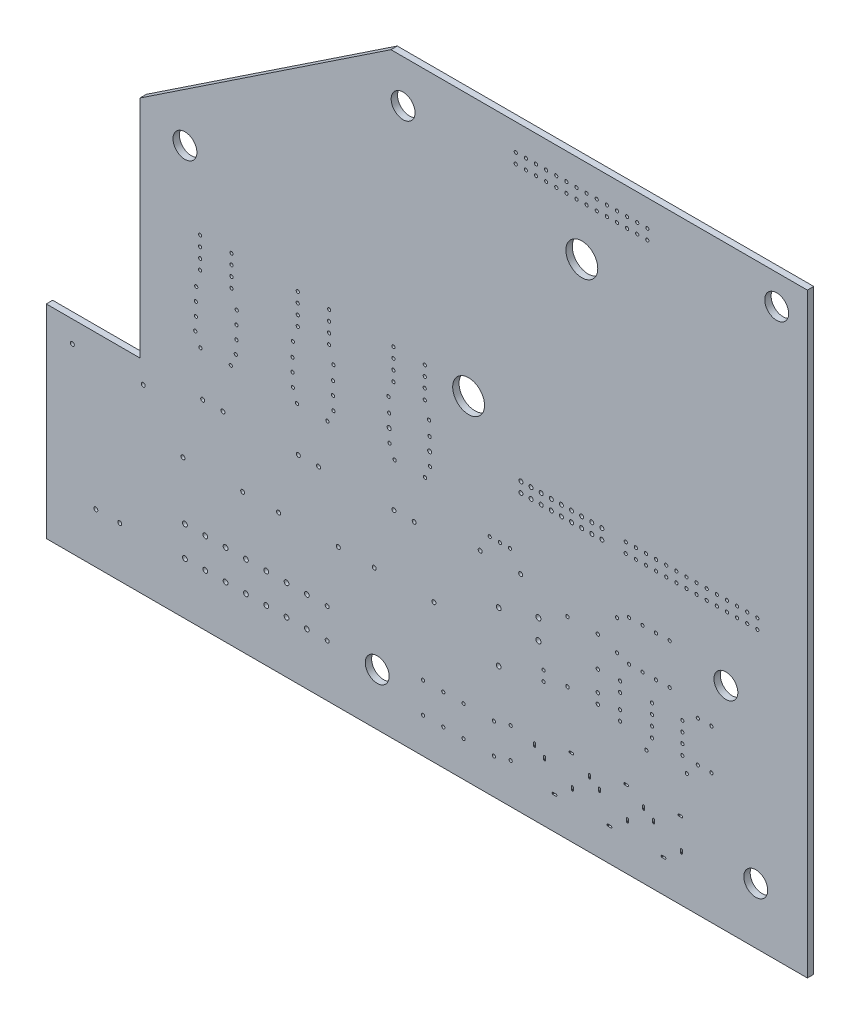
from build123d import *

# Parameters (mm, degrees)
SKETCH1_R           = 3
SKETCH1_R_2         = 0.4
SKETCH1_R_3         = 0.425
SKETCH1_R_4         = 0.65
SKETCH1_R_5         = 0.6
SKETCH1_R_6         = 0.5
SKETCH1_R_7         = 4
BOSS_EXTRUDE1_DEPTH = 1.6


with BuildPart() as part:
    # Sketch1 → Boss-Extrude1 (new body)
    with BuildSketch(Plane(origin=(0, 0, 0), x_dir=(-1, 0, 0), z_dir=(0, 0, -1))):
        Polygon((-318, -203.5), (-127, -203.5), (-127, -152.499999755), (-150.5, -152.499999755), (-150.5, -96), (-213.5, -54), (-318, -54), align=None)
        with Locations(Location((-305.05, -189.44, 0), (0, 0, 180))):
            Circle(SKETCH1_R, mode=Mode.SUBTRACT)
        with Locations(Location((-293.91, -170.95, 0), (0, 0, 180))):
            Circle(SKETCH1_R_2, mode=Mode.SUBTRACT)
        with Locations(Location((-287.755, -174.19, 0), (0, 0, 180))):
            Circle(SKETCH1_R_2, mode=Mode.SUBTRACT)
        with Locations(Location((-290.51, -170.95, 0), (0, 0, 180))):
            Circle(SKETCH1_R_2, mode=Mode.SUBTRACT)
        with Locations(Location((-286.625, -170.81, 0), (0, 0, 180))):
            Circle(SKETCH1_R_2, mode=Mode.SUBTRACT)
        with Locations(Location((-277.595, -174.19, 0), (0, 0, 180))):
            Circle(SKETCH1_R_2, mode=Mode.SUBTRACT)
        with Locations(Location((-279.005, -170.81, 0), (0, 0, 180))):
            Circle(SKETCH1_R_2, mode=Mode.SUBTRACT)
        with Locations(Location((-271.005, -171.19, 0), (0, 0, 180))):
            Circle(SKETCH1_R_2, mode=Mode.SUBTRACT)
        with Locations(Location((-286.625, -168.27, 0), (0, 0, 180))):
            Circle(SKETCH1_R_2, mode=Mode.SUBTRACT)
        with Locations(Location((-286.625, -165.73, 0), (0, 0, 180))):
            Circle(SKETCH1_R_2, mode=Mode.SUBTRACT)
        with Locations(Location((-286.625, -163.19, 0), (0, 0, 180))):
            Circle(SKETCH1_R_2, mode=Mode.SUBTRACT)
        with Locations(Location((-279.005, -168.27, 0), (0, 0, 180))):
            Circle(SKETCH1_R_2, mode=Mode.SUBTRACT)
        with Locations(Location((-279.005, -165.73, 0), (0, 0, 180))):
            Circle(SKETCH1_R_2, mode=Mode.SUBTRACT)
        with Locations(Location((-271.005, -168.69, 0), (0, 0, 180))):
            Circle(SKETCH1_R_2, mode=Mode.SUBTRACT)
        with Locations(Location((-279.005, -163.19, 0), (0, 0, 180))):
            Circle(SKETCH1_R_2, mode=Mode.SUBTRACT)
        with Locations(Location((-271.005, -164.94, 0), (0, 0, 180))):
            Circle(SKETCH1_R_2, mode=Mode.SUBTRACT)
        with Locations(Location((-271.005, -162.44, 0), (0, 0, 180))):
            Circle(SKETCH1_R_2, mode=Mode.SUBTRACT)
        with Locations(Location((-243.55, -193.44, 0), (0, 0, 180))):
            Circle(SKETCH1_R_2, mode=Mode.SUBTRACT)
        with Locations(Location((-239.34, -194.62, 0), (0, 0, 180))):
            Circle(SKETCH1_R_2, mode=Mode.SUBTRACT)
        with Locations(Location((-239.34, -187, 0), (0, 0, 180))):
            Circle(SKETCH1_R_2, mode=Mode.SUBTRACT)
        with Locations(Location((-231.72, -194.62, 0), (0, 0, 180))):
            Circle(SKETCH1_R_2, mode=Mode.SUBTRACT)
        with Locations(Location((-226.64, -194.62, 0), (0, 0, 180))):
            Circle(SKETCH1_R_2, mode=Mode.SUBTRACT)
        with Locations(Location((-231.72, -187, 0), (0, 0, 180))):
            Circle(SKETCH1_R_2, mode=Mode.SUBTRACT)
        with Locations(Location((-226.64, -187, 0), (0, 0, 180))):
            Circle(SKETCH1_R_2, mode=Mode.SUBTRACT)
        with Locations(Location((-243.55, -185.82, 0), (0, 0, 180))):
            Circle(SKETCH1_R_2, mode=Mode.SUBTRACT)
        with Locations(Location((-265.42, -170.31, 0), (0, 0, 180))):
            Circle(SKETCH1_R_3, mode=Mode.SUBTRACT)
        with Locations(Location((-257.8, -170.31, 0), (0, 0, 180))):
            Circle(SKETCH1_R_3, mode=Mode.SUBTRACT)
        with Locations(Location((-251.8, -172.19, 0), (0, 0, 180))):
            Circle(SKETCH1_R_2, mode=Mode.SUBTRACT)
        with Locations(Location((-265.42, -167.77, 0), (0, 0, 180))):
            Circle(SKETCH1_R_3, mode=Mode.SUBTRACT)
        with Locations(Location((-265.42, -162.69, 0), (0, 0, 180))):
            Circle(SKETCH1_R_3, mode=Mode.SUBTRACT)
        with Locations(Location((-251.8, -169.69, 0), (0, 0, 180))):
            Circle(SKETCH1_R_2, mode=Mode.SUBTRACT)
        with Locations(Location((-250.5, -163.94, 0), (0, 0, 180))):
            Circle(SKETCH1_R_4, mode=Mode.SUBTRACT)
        with Locations(Location((-240.55, -174.44, 0), (0, 0, 180))):
            Circle(SKETCH1_R_5, mode=Mode.SUBTRACT)
        with Locations(Location((-240.55, -161.74, 0), (0, 0, 180))):
            Circle(SKETCH1_R_5, mode=Mode.SUBTRACT)
        with Locations(Location((-224.293, -168.683, 0), (0, 0, 180))):
            Circle(SKETCH1_R_6, mode=Mode.SUBTRACT)
        with Locations(Location((-293.91, -160.79, 0), (0, 0, 180))):
            Circle(SKETCH1_R_2, mode=Mode.SUBTRACT)
        with Locations(Location((-297.55, -150.19, 0), (0, 0, 180))):
            Circle(SKETCH1_R, mode=Mode.SUBTRACT)
        with Locations(Location((-290.51, -160.79, 0), (0, 0, 180))):
            Circle(SKETCH1_R_2, mode=Mode.SUBTRACT)
        with Locations(Location((-283.449999, -157.635001, 0), (0, 0, 180))):
            Circle(SKETCH1_R_2, mode=Mode.SUBTRACT)
        with Locations(Location((-280.005, -157.69, 0), (0, 0, 180))):
            Circle(SKETCH1_R_2, mode=Mode.SUBTRACT)
        with Locations(Location((-276.64, -157.69, 0), (0, 0, 180))):
            Circle(SKETCH1_R_2, mode=Mode.SUBTRACT)
        with Locations(Location((-273.255, -157.69, 0), (0, 0, 180))):
            Circle(SKETCH1_R_2, mode=Mode.SUBTRACT)
        with Locations(Location((-270.255, -156.69, 0), (0, 0, 180))):
            Circle(SKETCH1_R_2, mode=Mode.SUBTRACT)
        with Locations(Location((-283.449999, -147.475001, 0), (0, 0, 180))):
            Circle(SKETCH1_R_2, mode=Mode.SUBTRACT)
        with Locations(Location((-280.005, -147.53, 0), (0, 0, 180))):
            Circle(SKETCH1_R_2, mode=Mode.SUBTRACT)
        with Locations(Location((-270.255, -149.07, 0), (0, 0, 180))):
            Circle(SKETCH1_R_2, mode=Mode.SUBTRACT)
        with Locations(Location((-276.64, -147.53, 0), (0, 0, 180))):
            Circle(SKETCH1_R_2, mode=Mode.SUBTRACT)
        with Locations(Location((-273.255, -147.53, 0), (0, 0, 180))):
            Circle(SKETCH1_R_2, mode=Mode.SUBTRACT)
        with Locations(Location((-305.44, -134.04, 0), (0, 0, 180))):
            Circle(SKETCH1_R_2, mode=Mode.SUBTRACT)
        with Locations(Location((-302.9, -134.04, 0), (0, 0, 180))):
            Circle(SKETCH1_R_2, mode=Mode.SUBTRACT)
        with Locations(Location((-305.44, -131.5, 0), (0, 0, 180))):
            Circle(SKETCH1_R_2, mode=Mode.SUBTRACT)
        with Locations(Location((-302.9, -131.5, 0), (0, 0, 180))):
            Circle(SKETCH1_R_2, mode=Mode.SUBTRACT)
        with Locations(Location((-300.36, -134.04, 0), (0, 0, 180))):
            Circle(SKETCH1_R_2, mode=Mode.SUBTRACT)
        with Locations(Location((-297.82, -134.04, 0), (0, 0, 180))):
            Circle(SKETCH1_R_2, mode=Mode.SUBTRACT)
        with Locations(Location((-300.36, -131.5, 0), (0, 0, 180))):
            Circle(SKETCH1_R_2, mode=Mode.SUBTRACT)
        with Locations(Location((-297.82, -131.5, 0), (0, 0, 180))):
            Circle(SKETCH1_R_2, mode=Mode.SUBTRACT)
        with Locations(Location((-295.28, -134.04, 0), (0, 0, 180))):
            Circle(SKETCH1_R_2, mode=Mode.SUBTRACT)
        with Locations(Location((-292.74, -134.04, 0), (0, 0, 180))):
            Circle(SKETCH1_R_2, mode=Mode.SUBTRACT)
        with Locations(Location((-295.28, -131.5, 0), (0, 0, 180))):
            Circle(SKETCH1_R_2, mode=Mode.SUBTRACT)
        with Locations(Location((-292.74, -131.5, 0), (0, 0, 180))):
            Circle(SKETCH1_R_2, mode=Mode.SUBTRACT)
        with Locations(Location((-290.2, -134.04, 0), (0, 0, 180))):
            Circle(SKETCH1_R_2, mode=Mode.SUBTRACT)
        with Locations(Location((-287.66, -134.04, 0), (0, 0, 180))):
            Circle(SKETCH1_R_2, mode=Mode.SUBTRACT)
        with Locations(Location((-290.2, -131.5, 0), (0, 0, 180))):
            Circle(SKETCH1_R_2, mode=Mode.SUBTRACT)
        with Locations(Location((-287.66, -131.5, 0), (0, 0, 180))):
            Circle(SKETCH1_R_2, mode=Mode.SUBTRACT)
        with Locations(Location((-285.12, -134.04, 0), (0, 0, 180))):
            Circle(SKETCH1_R_2, mode=Mode.SUBTRACT)
        with Locations(Location((-282.58, -134.04, 0), (0, 0, 180))):
            Circle(SKETCH1_R_2, mode=Mode.SUBTRACT)
        with Locations(Location((-280.04, -134.04, 0), (0, 0, 180))):
            Circle(SKETCH1_R_2, mode=Mode.SUBTRACT)
        with Locations(Location((-285.12, -131.5, 0), (0, 0, 180))):
            Circle(SKETCH1_R_2, mode=Mode.SUBTRACT)
        with Locations(Location((-282.58, -131.5, 0), (0, 0, 180))):
            Circle(SKETCH1_R_2, mode=Mode.SUBTRACT)
        with Locations(Location((-280.04, -131.5, 0), (0, 0, 180))):
            Circle(SKETCH1_R_2, mode=Mode.SUBTRACT)
        with Locations(Location((-277.5, -134.04, 0), (0, 0, 180))):
            Circle(SKETCH1_R_2, mode=Mode.SUBTRACT)
        with Locations(Location((-274.96, -134.04, 0), (0, 0, 180))):
            Circle(SKETCH1_R_2, mode=Mode.SUBTRACT)
        with Locations(Location((-277.5, -131.5, 0), (0, 0, 180))):
            Circle(SKETCH1_R_2, mode=Mode.SUBTRACT)
        with Locations(Location((-274.96, -131.5, 0), (0, 0, 180))):
            Circle(SKETCH1_R_2, mode=Mode.SUBTRACT)
        with Locations(Location((-272.42, -134.04, 0), (0, 0, 180))):
            Circle(SKETCH1_R_2, mode=Mode.SUBTRACT)
        with Locations(Location((-272.42, -131.5, 0), (0, 0, 180))):
            Circle(SKETCH1_R_2, mode=Mode.SUBTRACT)
        with Locations(Location((-265.42, -155.07, 0), (0, 0, 180))):
            Circle(SKETCH1_R_3, mode=Mode.SUBTRACT)
        with Locations(Location((-257.8, -155.07, 0), (0, 0, 180))):
            Circle(SKETCH1_R_3, mode=Mode.SUBTRACT)
        with Locations(Location((-250.5, -158.94, 0), (0, 0, 180))):
            Circle(SKETCH1_R_4, mode=Mode.SUBTRACT)
        with Locations(Location((-246.05, -151.69, 0), (0, 0, 180))):
            Circle(SKETCH1_R_6, mode=Mode.SUBTRACT)
        with Locations(Location((-235.89, -151.69, 0), (0, 0, 180))):
            Circle(SKETCH1_R_6, mode=Mode.SUBTRACT)
        with Locations(Location((-243.38, -147.44, 0), (0, 0, 180))):
            Circle(SKETCH1_R_2, mode=Mode.SUBTRACT)
        with Locations(Location((-240.84, -147.44, 0), (0, 0, 180))):
            Circle(SKETCH1_R_2, mode=Mode.SUBTRACT)
        with Locations(Location((-238.3, -147.44, 0), (0, 0, 180))):
            Circle(SKETCH1_R_2, mode=Mode.SUBTRACT)
        with Locations(Location((-266.44, -134.04, 0), (0, 0, 180))):
            Circle(SKETCH1_R_6, mode=Mode.SUBTRACT)
        with Locations(Location((-263.9, -134.04, 0), (0, 0, 180))):
            Circle(SKETCH1_R_6, mode=Mode.SUBTRACT)
        with Locations(Location((-266.44, -131.5, 0), (0, 0, 180))):
            Circle(SKETCH1_R_6, mode=Mode.SUBTRACT)
        with Locations(Location((-263.9, -131.5, 0), (0, 0, 180))):
            Circle(SKETCH1_R_6, mode=Mode.SUBTRACT)
        with Locations(Location((-261.36, -134.04, 0), (0, 0, 180))):
            Circle(SKETCH1_R_6, mode=Mode.SUBTRACT)
        with Locations(Location((-258.82, -134.04, 0), (0, 0, 180))):
            Circle(SKETCH1_R_6, mode=Mode.SUBTRACT)
        with Locations(Location((-261.36, -131.5, 0), (0, 0, 180))):
            Circle(SKETCH1_R_6, mode=Mode.SUBTRACT)
        with Locations(Location((-258.82, -131.5, 0), (0, 0, 180))):
            Circle(SKETCH1_R_6, mode=Mode.SUBTRACT)
        with Locations(Location((-256.28, -134.04, 0), (0, 0, 180))):
            Circle(SKETCH1_R_6, mode=Mode.SUBTRACT)
        with Locations(Location((-253.74, -134.04, 0), (0, 0, 180))):
            Circle(SKETCH1_R_6, mode=Mode.SUBTRACT)
        with Locations(Location((-256.28, -131.5, 0), (0, 0, 180))):
            Circle(SKETCH1_R_6, mode=Mode.SUBTRACT)
        with Locations(Location((-253.74, -131.5, 0), (0, 0, 180))):
            Circle(SKETCH1_R_6, mode=Mode.SUBTRACT)
        with Locations(Location((-251.2, -134.04, 0), (0, 0, 180))):
            Circle(SKETCH1_R_6, mode=Mode.SUBTRACT)
        with Locations(Location((-248.66, -134.04, 0), (0, 0, 180))):
            Circle(SKETCH1_R_6, mode=Mode.SUBTRACT)
        with Locations(Location((-246.12, -134.04, 0), (0, 0, 180))):
            Circle(SKETCH1_R_6, mode=Mode.SUBTRACT)
        with Locations(Location((-251.2, -131.5, 0), (0, 0, 180))):
            Circle(SKETCH1_R_6, mode=Mode.SUBTRACT)
        with Locations(Location((-248.66, -131.5, 0), (0, 0, 180))):
            Circle(SKETCH1_R_6, mode=Mode.SUBTRACT)
        with Locations(Location((-246.12, -131.5, 0), (0, 0, 180))):
            Circle(SKETCH1_R_6, mode=Mode.SUBTRACT)
        with Locations(Location((-223.3, -139.69, 0), (0, 0, 180))):
            Circle(SKETCH1_R_2, mode=Mode.SUBTRACT)
        with Locations(Location((-223.21, -136.44, 0), (0, 0, 180))):
            Circle(SKETCH1_R_6, mode=Mode.SUBTRACT)
        with Locations(Location((-223.21, -133.19, 0), (0, 0, 180))):
            Circle(SKETCH1_R_2, mode=Mode.SUBTRACT)
        with Locations(Location((-221.56, -194.62, 0), (0, 0, 180))):
            Circle(SKETCH1_R_2, mode=Mode.SUBTRACT)
        with Locations(Location((-221.56, -187, 0), (0, 0, 180))):
            Circle(SKETCH1_R_2, mode=Mode.SUBTRACT)
        with Locations(Location((-210.05, -190.44, 0), (0, 0, 180))):
            Circle(SKETCH1_R, mode=Mode.SUBTRACT)
        with Locations(Location((-197.5, -190.44, 0), (0, 0, 180))):
            Circle(SKETCH1_R_6, mode=Mode.SUBTRACT)
        with Locations(Location((-192.4, -190.44, 0), (0, 0, 180))):
            Circle(SKETCH1_R_5, mode=Mode.SUBTRACT)
        with Locations(Location((-187.3, -190.44, 0), (0, 0, 180))):
            Circle(SKETCH1_R_5, mode=Mode.SUBTRACT)
        with Locations(Location((-182.2, -190.44, 0), (0, 0, 180))):
            Circle(SKETCH1_R_5, mode=Mode.SUBTRACT)
        with Locations(Location((-197.5, -182.94, 0), (0, 0, 180))):
            Circle(SKETCH1_R_6, mode=Mode.SUBTRACT)
        with Locations(Location((-192.4, -182.94, 0), (0, 0, 180))):
            Circle(SKETCH1_R_5, mode=Mode.SUBTRACT)
        with Locations(Location((-187.3, -182.94, 0), (0, 0, 180))):
            Circle(SKETCH1_R_5, mode=Mode.SUBTRACT)
        with Locations(Location((-182.2, -182.94, 0), (0, 0, 180))):
            Circle(SKETCH1_R_5, mode=Mode.SUBTRACT)
        with Locations(Location((-209.307, -168.683, 0), (0, 0, 180))):
            Circle(SKETCH1_R_6, mode=Mode.SUBTRACT)
        with Locations(Location((-200.293, -168.683, 0), (0, 0, 180))):
            Circle(SKETCH1_R_6, mode=Mode.SUBTRACT)
        with Locations(Location((-185.307, -168.683, 0), (0, 0, 180))):
            Circle(SKETCH1_R_6, mode=Mode.SUBTRACT)
        with Locations(Location((-177.1, -190.44, 0), (0, 0, 180))):
            Circle(SKETCH1_R_5, mode=Mode.SUBTRACT)
        with Locations(Location((-172, -190.44, 0), (0, 0, 180))):
            Circle(SKETCH1_R_5, mode=Mode.SUBTRACT)
        with Locations(Location((-166.9, -190.44, 0), (0, 0, 180))):
            Circle(SKETCH1_R_5, mode=Mode.SUBTRACT)
        with Locations(Location((-161.8, -190.44, 0), (0, 0, 180))):
            Circle(SKETCH1_R_5, mode=Mode.SUBTRACT)
        with Locations(Location((-177.1, -182.94, 0), (0, 0, 180))):
            Circle(SKETCH1_R_5, mode=Mode.SUBTRACT)
        with Locations(Location((-172, -182.94, 0), (0, 0, 180))):
            Circle(SKETCH1_R_5, mode=Mode.SUBTRACT)
        with Locations(Location((-166.9, -182.94, 0), (0, 0, 180))):
            Circle(SKETCH1_R_5, mode=Mode.SUBTRACT)
        with Locations(Location((-161.8, -182.94, 0), (0, 0, 180))):
            Circle(SKETCH1_R_5, mode=Mode.SUBTRACT)
        with Locations(Location((-145.44, -190.91, 0), (0, 0, 180))):
            Circle(SKETCH1_R_6, mode=Mode.SUBTRACT)
        with Locations(Location((-139.44, -190.91, 0), (0, 0, 180))):
            Circle(SKETCH1_R_6, mode=Mode.SUBTRACT)
        with Locations(Location((-176.293, -168.683, 0), (0, 0, 180))):
            Circle(SKETCH1_R_6, mode=Mode.SUBTRACT)
        with Locations(Location((-161.307, -168.683, 0), (0, 0, 180))):
            Circle(SKETCH1_R_6, mode=Mode.SUBTRACT)
        with Locations(Location((-219.34, -153.697, 0), (0, 0, 180))):
            Circle(SKETCH1_R_6, mode=Mode.SUBTRACT)
        with Locations(Location((-214.26, -153.697, 0), (0, 0, 180))):
            Circle(SKETCH1_R_6, mode=Mode.SUBTRACT)
        with Locations(Location((-195.34, -153.697, 0), (0, 0, 180))):
            Circle(SKETCH1_R_6, mode=Mode.SUBTRACT)
        with Locations(Location((-190.26, -153.697, 0), (0, 0, 180))):
            Circle(SKETCH1_R_6, mode=Mode.SUBTRACT)
        with Locations(Location((-222.05, -142.69, 0), (0, 0, 180))):
            Circle(SKETCH1_R_2, mode=Mode.SUBTRACT)
        with Locations(Location((-214.43, -142.69, 0), (0, 0, 180))):
            Circle(SKETCH1_R_2, mode=Mode.SUBTRACT)
        with Locations(Location((-213.14, -139.69, 0), (0, 0, 180))):
            Circle(SKETCH1_R_2, mode=Mode.SUBTRACT)
        with Locations(Location((-213.05, -136.44, 0), (0, 0, 180))):
            Circle(SKETCH1_R_6, mode=Mode.SUBTRACT)
        with Locations(Location((-213.05, -133.19, 0), (0, 0, 180))):
            Circle(SKETCH1_R_2, mode=Mode.SUBTRACT)
        with Locations(Location((-223.05, -129.69, 0), (0, 0, 180))):
            Circle(SKETCH1_R_2, mode=Mode.SUBTRACT)
        with Locations(Location((-212.89, -129.69, 0), (0, 0, 180))):
            Circle(SKETCH1_R_2, mode=Mode.SUBTRACT)
        with Locations(Location((-197.55, -142.69, 0), (0, 0, 180))):
            Circle(SKETCH1_R_2, mode=Mode.SUBTRACT)
        with Locations(Location((-189.93, -142.69, 0), (0, 0, 180))):
            Circle(SKETCH1_R_2, mode=Mode.SUBTRACT)
        with Locations(Location((-199.05, -139.69, 0), (0, 0, 180))):
            Circle(SKETCH1_R_2, mode=Mode.SUBTRACT)
        with Locations(Location((-198.96, -136.44, 0), (0, 0, 180))):
            Circle(SKETCH1_R_2, mode=Mode.SUBTRACT)
        with Locations(Location((-188.89, -139.69, 0), (0, 0, 180))):
            Circle(SKETCH1_R_2, mode=Mode.SUBTRACT)
        with Locations(Location((-188.8, -136.44, 0), (0, 0, 180))):
            Circle(SKETCH1_R_2, mode=Mode.SUBTRACT)
        with Locations(Location((-198.96, -133.19, 0), (0, 0, 180))):
            Circle(SKETCH1_R_2, mode=Mode.SUBTRACT)
        with Locations(Location((-199.05, -129.69, 0), (0, 0, 180))):
            Circle(SKETCH1_R_2, mode=Mode.SUBTRACT)
        with Locations(Location((-188.8, -133.19, 0), (0, 0, 180))):
            Circle(SKETCH1_R_2, mode=Mode.SUBTRACT)
        with Locations(Location((-188.89, -129.69, 0), (0, 0, 180))):
            Circle(SKETCH1_R_2, mode=Mode.SUBTRACT)
        with Locations(Location((-171.34, -153.697, 0), (0, 0, 180))):
            Circle(SKETCH1_R_6, mode=Mode.SUBTRACT)
        with Locations(Location((-166.26, -153.697, 0), (0, 0, 180))):
            Circle(SKETCH1_R_6, mode=Mode.SUBTRACT)
        with Locations(Location((-151.34, -157.91, 0), (0, 0, 180))):
            Circle(SKETCH1_R_6, mode=Mode.SUBTRACT)
        with Locations(Location((-133.54, -157.91, 0), (0, 0, 180))):
            Circle(SKETCH1_R_6, mode=Mode.SUBTRACT)
        with Locations(Location((-173.3, -142.69, 0), (0, 0, 180))):
            Circle(SKETCH1_R_2, mode=Mode.SUBTRACT)
        with Locations(Location((-174.55, -139.69, 0), (0, 0, 180))):
            Circle(SKETCH1_R_2, mode=Mode.SUBTRACT)
        with Locations(Location((-174.71, -136.44, 0), (0, 0, 180))):
            Circle(SKETCH1_R_2, mode=Mode.SUBTRACT)
        with Locations(Location((-165.68, -142.69, 0), (0, 0, 180))):
            Circle(SKETCH1_R_2, mode=Mode.SUBTRACT)
        with Locations(Location((-164.39, -139.69, 0), (0, 0, 180))):
            Circle(SKETCH1_R_2, mode=Mode.SUBTRACT)
        with Locations(Location((-164.55, -136.44, 0), (0, 0, 180))):
            Circle(SKETCH1_R_2, mode=Mode.SUBTRACT)
        with Locations(Location((-174.71, -133.19, 0), (0, 0, 180))):
            Circle(SKETCH1_R_2, mode=Mode.SUBTRACT)
        with Locations(Location((-174.8, -129.94, 0), (0, 0, 180))):
            Circle(SKETCH1_R_2, mode=Mode.SUBTRACT)
        with Locations(Location((-164.55, -133.19, 0), (0, 0, 180))):
            Circle(SKETCH1_R_2, mode=Mode.SUBTRACT)
        with Locations(Location((-164.64, -129.94, 0), (0, 0, 180))):
            Circle(SKETCH1_R_2, mode=Mode.SUBTRACT)
        with Locations(Location((-232.99, -119.55, 0), (0, 0, 180))):
            Circle(SKETCH1_R_7, mode=Mode.SUBTRACT)
        with Locations(Location((-310.3, -61.44, 0), (0, 0, 180))):
            Circle(SKETCH1_R, mode=Mode.SUBTRACT)
        with Locations(Location((-277.84, -63.2, 0), (0, 0, 180))):
            Circle(SKETCH1_R_2, mode=Mode.SUBTRACT)
        with Locations(Location((-275.3, -63.2, 0), (0, 0, 180))):
            Circle(SKETCH1_R_2, mode=Mode.SUBTRACT)
        with Locations(Location((-272.76, -63.2, 0), (0, 0, 180))):
            Circle(SKETCH1_R_2, mode=Mode.SUBTRACT)
        with Locations(Location((-270.22, -63.2, 0), (0, 0, 180))):
            Circle(SKETCH1_R_2, mode=Mode.SUBTRACT)
        with Locations(Location((-277.84, -60.66, 0), (0, 0, 180))):
            Circle(SKETCH1_R_2, mode=Mode.SUBTRACT)
        with Locations(Location((-275.3, -60.66, 0), (0, 0, 180))):
            Circle(SKETCH1_R_2, mode=Mode.SUBTRACT)
        with Locations(Location((-272.76, -60.66, 0), (0, 0, 180))):
            Circle(SKETCH1_R_2, mode=Mode.SUBTRACT)
        with Locations(Location((-270.22, -60.66, 0), (0, 0, 180))):
            Circle(SKETCH1_R_2, mode=Mode.SUBTRACT)
        with Locations(Location((-261.4, -75.61, 0), (0, 0, 180))):
            Circle(SKETCH1_R_7, mode=Mode.SUBTRACT)
        with Locations(Location((-267.68, -63.2, 0), (0, 0, 180))):
            Circle(SKETCH1_R_2, mode=Mode.SUBTRACT)
        with Locations(Location((-265.14, -63.2, 0), (0, 0, 180))):
            Circle(SKETCH1_R_2, mode=Mode.SUBTRACT)
        with Locations(Location((-262.6, -63.2, 0), (0, 0, 180))):
            Circle(SKETCH1_R_2, mode=Mode.SUBTRACT)
        with Locations(Location((-260.06, -63.2, 0), (0, 0, 180))):
            Circle(SKETCH1_R_2, mode=Mode.SUBTRACT)
        with Locations(Location((-257.52, -63.2, 0), (0, 0, 180))):
            Circle(SKETCH1_R_2, mode=Mode.SUBTRACT)
        with Locations(Location((-267.68, -60.66, 0), (0, 0, 180))):
            Circle(SKETCH1_R_2, mode=Mode.SUBTRACT)
        with Locations(Location((-265.14, -60.66, 0), (0, 0, 180))):
            Circle(SKETCH1_R_2, mode=Mode.SUBTRACT)
        with Locations(Location((-262.6, -60.66, 0), (0, 0, 180))):
            Circle(SKETCH1_R_2, mode=Mode.SUBTRACT)
        with Locations(Location((-260.06, -60.66, 0), (0, 0, 180))):
            Circle(SKETCH1_R_2, mode=Mode.SUBTRACT)
        with Locations(Location((-257.52, -60.66, 0), (0, 0, 180))):
            Circle(SKETCH1_R_2, mode=Mode.SUBTRACT)
        with Locations(Location((-254.98, -63.2, 0), (0, 0, 180))):
            Circle(SKETCH1_R_2, mode=Mode.SUBTRACT)
        with Locations(Location((-252.44, -63.2, 0), (0, 0, 180))):
            Circle(SKETCH1_R_2, mode=Mode.SUBTRACT)
        with Locations(Location((-249.9, -63.2, 0), (0, 0, 180))):
            Circle(SKETCH1_R_2, mode=Mode.SUBTRACT)
        with Locations(Location((-247.36, -63.2, 0), (0, 0, 180))):
            Circle(SKETCH1_R_2, mode=Mode.SUBTRACT)
        with Locations(Location((-254.98, -60.66, 0), (0, 0, 180))):
            Circle(SKETCH1_R_2, mode=Mode.SUBTRACT)
        with Locations(Location((-252.44, -60.66, 0), (0, 0, 180))):
            Circle(SKETCH1_R_2, mode=Mode.SUBTRACT)
        with Locations(Location((-249.9, -60.66, 0), (0, 0, 180))):
            Circle(SKETCH1_R_2, mode=Mode.SUBTRACT)
        with Locations(Location((-247.36, -60.66, 0), (0, 0, 180))):
            Circle(SKETCH1_R_2, mode=Mode.SUBTRACT)
        with Locations(Location((-244.82, -63.2, 0), (0, 0, 180))):
            Circle(SKETCH1_R_2, mode=Mode.SUBTRACT)
        with Locations(Location((-244.82, -60.66, 0), (0, 0, 180))):
            Circle(SKETCH1_R_2, mode=Mode.SUBTRACT)
        with Locations(Location((-221.985, -125.86, 0), (0, 0, 180))):
            Circle(SKETCH1_R_2, mode=Mode.SUBTRACT)
        with Locations(Location((-221.985, -123.32, 0), (0, 0, 180))):
            Circle(SKETCH1_R_2, mode=Mode.SUBTRACT)
        with Locations(Location((-214.115, -125.86, 0), (0, 0, 180))):
            Circle(SKETCH1_R_2, mode=Mode.SUBTRACT)
        with Locations(Location((-214.115, -123.32, 0), (0, 0, 180))):
            Circle(SKETCH1_R_2, mode=Mode.SUBTRACT)
        with Locations(Location((-221.985, -120.78, 0), (0, 0, 180))):
            Circle(SKETCH1_R_2, mode=Mode.SUBTRACT)
        with Locations(Location((-214.115, -120.78, 0), (0, 0, 180))):
            Circle(SKETCH1_R_2, mode=Mode.SUBTRACT)
        with Locations(Location((-221.985, -118.24, 0), (0, 0, 180))):
            Circle(SKETCH1_R_2, mode=Mode.SUBTRACT)
        with Locations(Location((-214.115, -118.24, 0), (0, 0, 180))):
            Circle(SKETCH1_R_2, mode=Mode.SUBTRACT)
        with Locations(Location((-197.985, -125.86, 0), (0, 0, 180))):
            Circle(SKETCH1_R_2, mode=Mode.SUBTRACT)
        with Locations(Location((-197.985, -123.32, 0), (0, 0, 180))):
            Circle(SKETCH1_R_2, mode=Mode.SUBTRACT)
        with Locations(Location((-190.115, -125.86, 0), (0, 0, 180))):
            Circle(SKETCH1_R_2, mode=Mode.SUBTRACT)
        with Locations(Location((-190.115, -123.32, 0), (0, 0, 180))):
            Circle(SKETCH1_R_2, mode=Mode.SUBTRACT)
        with Locations(Location((-197.985, -120.78, 0), (0, 0, 180))):
            Circle(SKETCH1_R_2, mode=Mode.SUBTRACT)
        with Locations(Location((-190.115, -120.78, 0), (0, 0, 180))):
            Circle(SKETCH1_R_2, mode=Mode.SUBTRACT)
        with Locations(Location((-197.985, -118.24, 0), (0, 0, 180))):
            Circle(SKETCH1_R_2, mode=Mode.SUBTRACT)
        with Locations(Location((-190.115, -118.24, 0), (0, 0, 180))):
            Circle(SKETCH1_R_2, mode=Mode.SUBTRACT)
        with Locations(Location((-173.485, -125.86, 0), (0, 0, 180))):
            Circle(SKETCH1_R_2, mode=Mode.SUBTRACT)
        with Locations(Location((-173.485, -123.32, 0), (0, 0, 180))):
            Circle(SKETCH1_R_2, mode=Mode.SUBTRACT)
        with Locations(Location((-173.485, -120.78, 0), (0, 0, 180))):
            Circle(SKETCH1_R_2, mode=Mode.SUBTRACT)
        with Locations(Location((-165.615, -125.86, 0), (0, 0, 180))):
            Circle(SKETCH1_R_2, mode=Mode.SUBTRACT)
        with Locations(Location((-165.615, -123.32, 0), (0, 0, 180))):
            Circle(SKETCH1_R_2, mode=Mode.SUBTRACT)
        with Locations(Location((-165.615, -120.78, 0), (0, 0, 180))):
            Circle(SKETCH1_R_2, mode=Mode.SUBTRACT)
        with Locations(Location((-173.485, -118.24, 0), (0, 0, 180))):
            Circle(SKETCH1_R_2, mode=Mode.SUBTRACT)
        with Locations(Location((-165.615, -118.24, 0), (0, 0, 180))):
            Circle(SKETCH1_R_2, mode=Mode.SUBTRACT)
        with Locations(Location((-161.8, -100.69, 0), (0, 0, 180))):
            Circle(SKETCH1_R, mode=Mode.SUBTRACT)
        with Locations(Location((-216.55, -64.69, 0), (0, 0, 180))):
            Circle(SKETCH1_R, mode=Mode.SUBTRACT)
        Polygon((-286.223223, -191.273223), (-286.16903, -191.354329), (-286.15, -191.45), (-286.15, -192.15), (-286.16903, -192.245671), (-286.223223, -192.326777), (-286.304329, -192.38097), (-286.4, -192.4), (-286.495671, -192.38097), (-286.576777, -192.326777), (-286.63097, -192.245671), (-286.65, -192.15), (-286.65, -191.45), (-286.63097, -191.354329), (-286.576777, -191.273223), (-286.495671, -191.21903), (-286.4, -191.2), (-286.304329, -191.21903), align=None, mode=Mode.SUBTRACT)
        Polygon((-282.426777, -195.123223), (-282.345671, -195.06903), (-282.25, -195.05), (-281.55, -195.05), (-281.454329, -195.06903), (-281.373223, -195.123223), (-281.31903, -195.204329), (-281.3, -195.3), (-281.31903, -195.395671), (-281.373223, -195.476777), (-281.454329, -195.53097), (-281.55, -195.55), (-282.25, -195.55), (-282.345671, -195.53097), (-282.426777, -195.476777), (-282.48097, -195.395671), (-282.5, -195.3), (-282.48097, -195.204329), align=None, mode=Mode.SUBTRACT)
        Polygon((-268.871777, -195.123223), (-268.790671, -195.06903), (-268.695, -195.05), (-267.995, -195.05), (-267.899329, -195.06903), (-267.818223, -195.123223), (-267.76403, -195.204329), (-267.745, -195.3), (-267.76403, -195.395671), (-267.818223, -195.476777), (-267.899329, -195.53097), (-267.995, -195.55), (-268.695, -195.55), (-268.790671, -195.53097), (-268.871777, -195.476777), (-268.92597, -195.395671), (-268.945, -195.3), (-268.92597, -195.204329), align=None, mode=Mode.SUBTRACT)
        Polygon((-272.668223, -191.273223), (-272.61403, -191.354329), (-272.595, -191.45), (-272.595, -192.15), (-272.61403, -192.245671), (-272.668223, -192.326777), (-272.749329, -192.38097), (-272.845, -192.4), (-272.940671, -192.38097), (-273.021777, -192.326777), (-273.07597, -192.245671), (-273.095, -192.15), (-273.095, -191.45), (-273.07597, -191.354329), (-273.021777, -191.273223), (-272.940671, -191.21903), (-272.845, -191.2), (-272.749329, -191.21903), align=None, mode=Mode.SUBTRACT)
        Polygon((-279.223223, -188.173223), (-279.16903, -188.254329), (-279.15, -188.35), (-279.15, -189.05), (-279.16903, -189.145671), (-279.223223, -189.226777), (-279.304329, -189.28097), (-279.4, -189.3), (-279.495671, -189.28097), (-279.576777, -189.226777), (-279.63097, -189.145671), (-279.65, -189.05), (-279.65, -188.35), (-279.63097, -188.254329), (-279.576777, -188.173223), (-279.495671, -188.11903), (-279.4, -188.1), (-279.304329, -188.11903), align=None, mode=Mode.SUBTRACT)
        Polygon((-276.723223, -186.473223), (-276.66903, -186.554329), (-276.65, -186.65), (-276.65, -187.35), (-276.66903, -187.445671), (-276.723223, -187.526777), (-276.804329, -187.58097), (-276.9, -187.6), (-276.995671, -187.58097), (-277.076777, -187.526777), (-277.13097, -187.445671), (-277.15, -187.35), (-277.15, -186.65), (-277.13097, -186.554329), (-277.076777, -186.473223), (-276.995671, -186.41903), (-276.9, -186.4), (-276.804329, -186.41903), align=None, mode=Mode.SUBTRACT)
        Polygon((-286.626777, -184.023223), (-286.545671, -183.96903), (-286.45, -183.95), (-285.75, -183.95), (-285.654329, -183.96903), (-285.573223, -184.023223), (-285.51903, -184.104329), (-285.5, -184.2), (-285.51903, -184.295671), (-285.573223, -184.376777), (-285.654329, -184.43097), (-285.75, -184.45), (-286.45, -184.45), (-286.545671, -184.43097), (-286.626777, -184.376777), (-286.68097, -184.295671), (-286.7, -184.2), (-286.68097, -184.104329), align=None, mode=Mode.SUBTRACT)
        Polygon((-273.071777, -184.023223), (-272.990671, -183.96903), (-272.895, -183.95), (-272.195, -183.95), (-272.099329, -183.96903), (-272.018223, -184.023223), (-271.96403, -184.104329), (-271.945, -184.2), (-271.96403, -184.295671), (-272.018223, -184.376777), (-272.099329, -184.43097), (-272.195, -184.45), (-272.895, -184.45), (-272.990671, -184.43097), (-273.071777, -184.376777), (-273.12597, -184.295671), (-273.145, -184.2), (-273.12597, -184.104329), align=None, mode=Mode.SUBTRACT)
        Polygon((-258.868223, -191.273223), (-258.81403, -191.354329), (-258.795, -191.45), (-258.795, -192.15), (-258.81403, -192.245671), (-258.868223, -192.326777), (-258.949329, -192.38097), (-259.045, -192.4), (-259.140671, -192.38097), (-259.221777, -192.326777), (-259.27597, -192.245671), (-259.295, -192.15), (-259.295, -191.45), (-259.27597, -191.354329), (-259.221777, -191.273223), (-259.140671, -191.21903), (-259.045, -191.2), (-258.949329, -191.21903), align=None, mode=Mode.SUBTRACT)
        Polygon((-265.668223, -188.173223), (-265.61403, -188.254329), (-265.595, -188.35), (-265.595, -189.05), (-265.61403, -189.145671), (-265.668223, -189.226777), (-265.749329, -189.28097), (-265.845, -189.3), (-265.940671, -189.28097), (-266.021777, -189.226777), (-266.07597, -189.145671), (-266.095, -189.05), (-266.095, -188.35), (-266.07597, -188.254329), (-266.021777, -188.173223), (-265.940671, -188.11903), (-265.845, -188.1), (-265.749329, -188.11903), align=None, mode=Mode.SUBTRACT)
        Polygon((-263.168223, -186.473223), (-263.11403, -186.554329), (-263.095, -186.65), (-263.095, -187.35), (-263.11403, -187.445671), (-263.168223, -187.526777), (-263.249329, -187.58097), (-263.345, -187.6), (-263.440671, -187.58097), (-263.521777, -187.526777), (-263.57597, -187.445671), (-263.595, -187.35), (-263.595, -186.65), (-263.57597, -186.554329), (-263.521777, -186.473223), (-263.440671, -186.41903), (-263.345, -186.4), (-263.249329, -186.41903), align=None, mode=Mode.SUBTRACT)
        Polygon((-255.071777, -195.123223), (-254.990671, -195.06903), (-254.895, -195.05), (-254.195, -195.05), (-254.099329, -195.06903), (-254.018223, -195.123223), (-253.96403, -195.204329), (-253.945, -195.3), (-253.96403, -195.395671), (-254.018223, -195.476777), (-254.099329, -195.53097), (-254.195, -195.55), (-254.895, -195.55), (-254.990671, -195.53097), (-255.071777, -195.476777), (-255.12597, -195.395671), (-255.145, -195.3), (-255.12597, -195.204329), align=None, mode=Mode.SUBTRACT)
        Polygon((-251.868223, -188.173223), (-251.81403, -188.254329), (-251.795, -188.35), (-251.795, -189.05), (-251.81403, -189.145671), (-251.868223, -189.226777), (-251.949329, -189.28097), (-252.045, -189.3), (-252.140671, -189.28097), (-252.221777, -189.226777), (-252.27597, -189.145671), (-252.295, -189.05), (-252.295, -188.35), (-252.27597, -188.254329), (-252.221777, -188.173223), (-252.140671, -188.11903), (-252.045, -188.1), (-251.949329, -188.11903), align=None, mode=Mode.SUBTRACT)
        Polygon((-249.368223, -186.473223), (-249.31403, -186.554329), (-249.295, -186.65), (-249.295, -187.35), (-249.31403, -187.445671), (-249.368223, -187.526777), (-249.449329, -187.58097), (-249.545, -187.6), (-249.640671, -187.58097), (-249.721777, -187.526777), (-249.77597, -187.445671), (-249.795, -187.35), (-249.795, -186.65), (-249.77597, -186.554329), (-249.721777, -186.473223), (-249.640671, -186.41903), (-249.545, -186.4), (-249.449329, -186.41903), align=None, mode=Mode.SUBTRACT)
        Polygon((-259.271777, -184.023223), (-259.190671, -183.96903), (-259.095, -183.95), (-258.395, -183.95), (-258.299329, -183.96903), (-258.218223, -184.023223), (-258.16403, -184.104329), (-258.145, -184.2), (-258.16403, -184.295671), (-258.218223, -184.376777), (-258.299329, -184.43097), (-258.395, -184.45), (-259.095, -184.45), (-259.190671, -184.43097), (-259.271777, -184.376777), (-259.32597, -184.295671), (-259.345, -184.2), (-259.32597, -184.104329), align=None, mode=Mode.SUBTRACT)
    extrude(amount=-BOSS_EXTRUDE1_DEPTH)


solid = part.part
